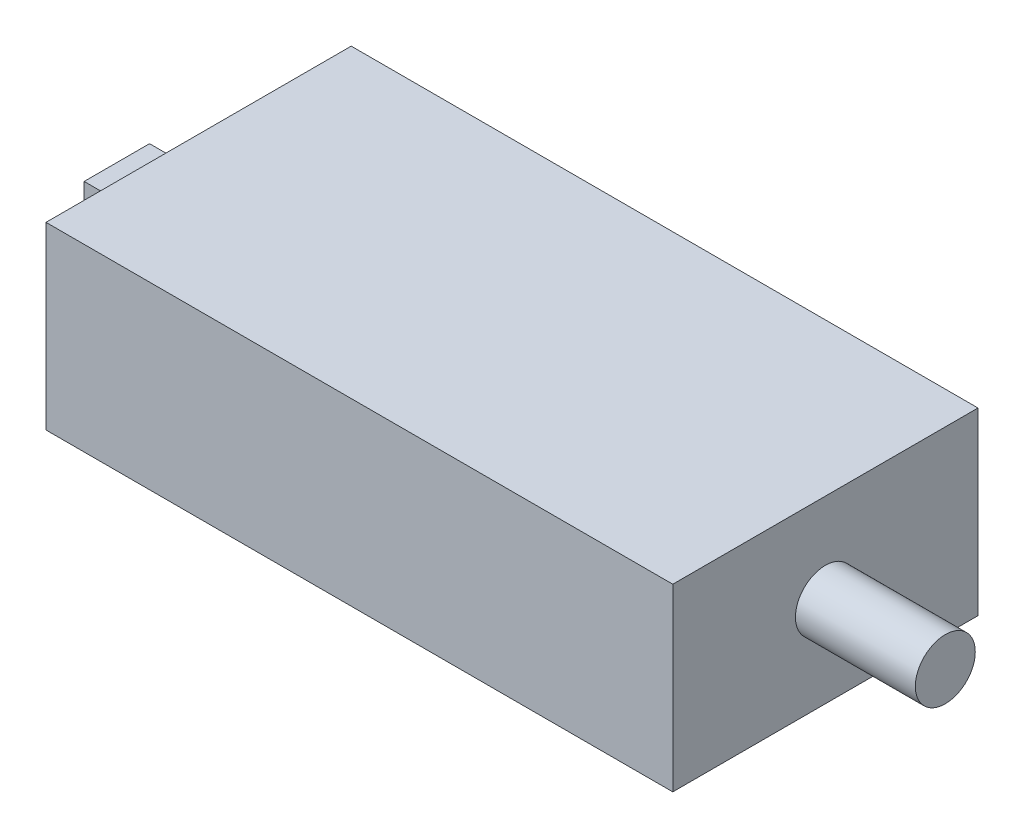
from build123d import *

# Parameters (mm, degrees)
SZKIC1_W                    = 115
SZKIC1_H                    = 56
DODANIE_WYCI_GNI_CIE1_DEPTH = 33
SZKIC2_R                    = 5.5
DODANIE_WYCI_GNI_CIE2_DEPTH = 22
DODANIE_WYCI_GNI_CIE3_DEPTH = 15


with BuildPart() as part:
    # Szkic1 → Dodanie-wyciągnięcie1 (new body)
    with BuildSketch(Plane(origin=(0, 0, 0), x_dir=(1, 0, 0), z_dir=(0, 1, 0))):
        with Locations((57.5, 28)):
            Rectangle(SZKIC1_W, SZKIC1_H)
    extrude(amount=DODANIE_WYCI_GNI_CIE1_DEPTH)

    # Szkic2 → Dodanie-wyciągnięcie2 (add)
    with BuildSketch(Plane(origin=(115, 0, 0), x_dir=(0, 0, -1), z_dir=(1, 0, 0))):
        with Locations((28, 16.5)):
            Circle(SZKIC2_R)
    extrude(amount=DODANIE_WYCI_GNI_CIE2_DEPTH)

    # Szkic3 → Dodanie-wyciągnięcie3 (add)
    with BuildSketch(Plane.ZY):
        Polygon((-34, 16.5), (-34, 12), (-22, 12), (-22, 16.5), (-22, 21), (-34, 21), align=None)
    extrude(amount=DODANIE_WYCI_GNI_CIE3_DEPTH)


solid = part.part
